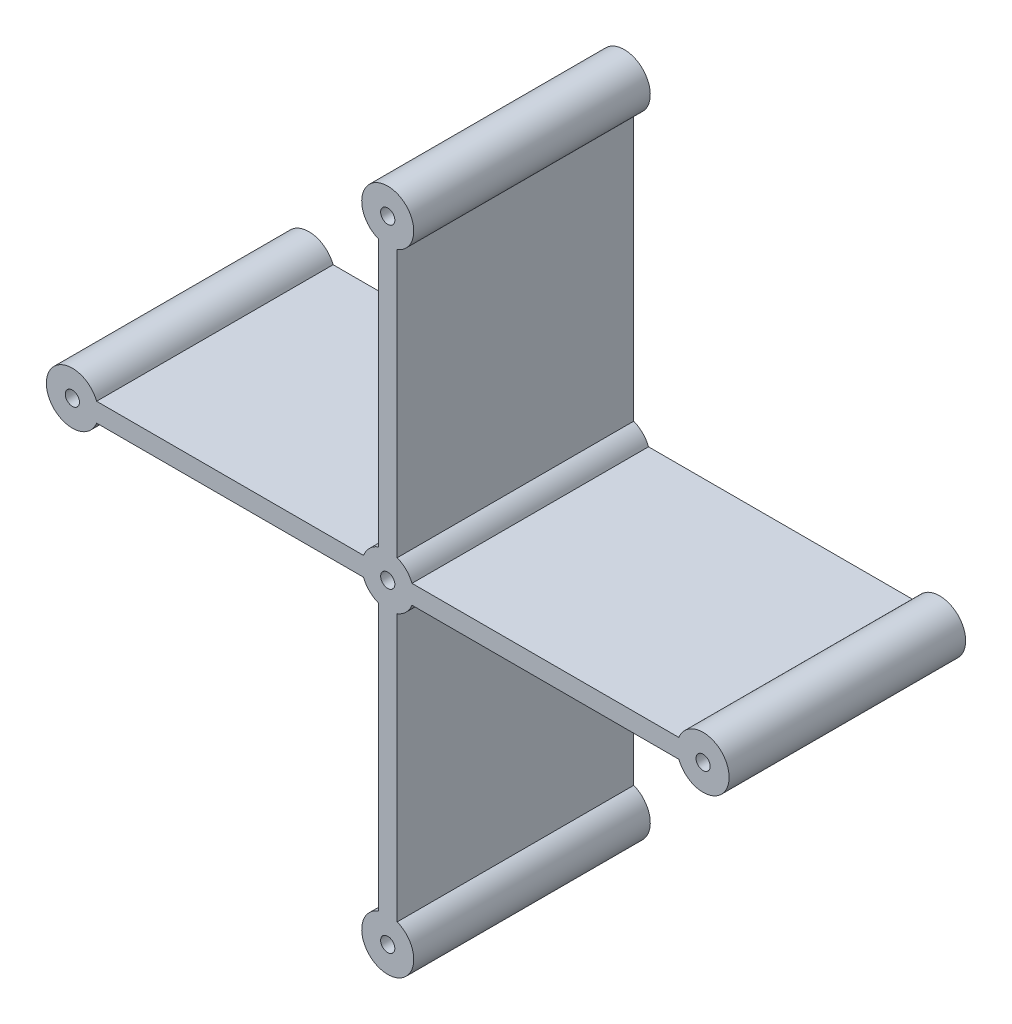
from build123d import *

# Parameters (mm, degrees)
BOSS_EXTRUDE1_DEPTH = 30
SKETCH1_3_R         = 0.9
CUT_EXTRUDE1_DEPTH  = 30


with BuildPart() as part:
    # Sketch1 → Boss-Extrude1 (new body)
    with BuildSketch(Plane.XY):
        with BuildLine():
            Line((-1.2, -1.2), (-1.2, 0))
            Line((-1.2, 0), (-1.2, 1.2))
            Line((-1.2, 1.2), (-3.07408523, 1.2))
            ThreePointArc((-3.07408523, 1.2), (-3.3, 0), (-3.07408523, -1.2))
            Line((-3.07408523, -1.2), (-1.2, -1.2))
        make_face()
        with BuildLine():
            ThreePointArc((0, -1.2), (-0.848528137, -0.848528137), (-1.2, 0))
            Line((-1.2, 0), (-1.2, -1.2))
            Line((-1.2, -1.2), (0, -1.2))
        make_face()
        with BuildLine():
            ThreePointArc((0, 1.2), (-0.848528137, 0.848528137), (-1.2, 0))
            ThreePointArc((-1.2, 0), (-0.848528137, -0.848528137), (0, -1.2))
            ThreePointArc((0, -1.2), (0.848528137, -0.848528137), (1.2, 0))
            ThreePointArc((1.2, 0), (0.848528137, 0.848528137), (0, 1.2))
        make_face()
        with BuildLine():
            Line((-1.2, 1.2), (-1.2, 0))
            ThreePointArc((-1.2, 0), (-0.848528137, 0.848528137), (0, 1.2))
            Line((0, 1.2), (-1.2, 1.2))
        make_face()
        with BuildLine():
            Line((-3.07408523, 1.2), (-1.2, 1.2))
            Line((-1.2, 1.2), (-1.2, 3.07408523))
            ThreePointArc((-1.2, 3.07408523), (-2.333452378, 2.333452378), (-3.07408523, 1.2))
        make_face()
        with BuildLine():
            Line((-1.2, 3.07408523), (-1.2, 1.2))
            Line((-1.2, 1.2), (0, 1.2))
            Line((0, 1.2), (1.2, 1.2))
            Line((1.2, 1.2), (1.2, 3.07408523))
            ThreePointArc((1.2, 3.07408523), (0, 3.3), (-1.2, 3.07408523))
        make_face()
        with BuildLine():
            Line((0, -1.2), (-1.2, -1.2))
            Line((-1.2, -1.2), (-1.2, -3.07408523))
            ThreePointArc((-1.2, -3.07408523), (0, -3.3), (1.2, -3.07408523))
            Line((1.2, -3.07408523), (1.2, -1.2))
            Line((1.2, -1.2), (0, -1.2))
        make_face()
        with BuildLine():
            Line((-1.2, -3.07408523), (-1.2, -1.2))
            Line((-1.2, -1.2), (-3.07408523, -1.2))
            ThreePointArc((-3.07408523, -1.2), (-2.333452378, -2.333452378), (-1.2, -3.07408523))
        make_face()
        with BuildLine():
            ThreePointArc((1.2, 0), (0.848528137, -0.848528137), (0, -1.2))
            Line((0, -1.2), (1.2, -1.2))
            Line((1.2, -1.2), (1.2, 0))
        make_face()
        with BuildLine():
            Line((1.2, 1.2), (0, 1.2))
            ThreePointArc((0, 1.2), (0.848528137, 0.848528137), (1.2, 0))
            Line((1.2, 0), (1.2, 1.2))
        make_face()
        with BuildLine():
            Line((-1.2, 36.92591477), (-1.2, 3.07408523))
            ThreePointArc((-1.2, 3.07408523), (0, 3.3), (1.2, 3.07408523))
            Line((1.2, 3.07408523), (1.2, 36.92591477))
            ThreePointArc((1.2, 36.92591477), (0, 36.7), (-1.2, 36.92591477))
        make_face()
        with BuildLine():
            ThreePointArc((-3.07408523, -1.2), (-3.3, 0), (-3.07408523, 1.2))
            Line((-3.07408523, 1.2), (-36.92591477, 1.2))
            ThreePointArc((-36.92591477, 1.2), (-36.756970455, 0.610540229), (-36.7, 0))
            ThreePointArc((-36.7, 0), (-36.756970455, -0.610540229), (-36.92591477, -1.2))
            Line((-36.92591477, -1.2), (-3.07408523, -1.2))
        make_face()
        with BuildLine():
            ThreePointArc((1.2, -3.07408523), (0, -3.3), (-1.2, -3.07408523))
            Line((-1.2, -3.07408523), (-1.2, -36.92591477))
            ThreePointArc((-1.2, -36.92591477), (0, -36.7), (1.2, -36.92591477))
            Line((1.2, -36.92591477), (1.2, -3.07408523))
        make_face()
        with BuildLine():
            Line((1.2, 0), (1.2, -1.2))
            Line((1.2, -1.2), (3.07408523, -1.2))
            ThreePointArc((3.07408523, -1.2), (3.243029545, -0.610540229), (3.3, 0))
            ThreePointArc((3.3, 0), (3.243029545, 0.610540229), (3.07408523, 1.2))
            Line((3.07408523, 1.2), (1.2, 1.2))
            Line((1.2, 1.2), (1.2, 0))
        make_face()
        with BuildLine():
            Line((3.07408523, -1.2), (1.2, -1.2))
            Line((1.2, -1.2), (1.2, -3.07408523))
            ThreePointArc((1.2, -3.07408523), (2.333452378, -2.333452378), (3.07408523, -1.2))
        make_face()
        with BuildLine():
            Line((1.2, 3.07408523), (1.2, 1.2))
            Line((1.2, 1.2), (3.07408523, 1.2))
            ThreePointArc((3.07408523, 1.2), (2.333452378, 2.333452378), (1.2, 3.07408523))
        make_face()
        with BuildLine():
            ThreePointArc((3.3, 40), (-1.861451047, 42.724885319), (-1.2, 36.92591477))
            Line((-1.2, 36.92591477), (-1.2, 40))
            ThreePointArc((-1.2, 40), (0, 41.2), (1.2, 40))
            Line((1.2, 40), (1.2, 36.92591477))
            ThreePointArc((1.2, 36.92591477), (2.724885319, 38.138548953), (3.3, 40))
        make_face()
        with BuildLine():
            Line((-1.2, 40), (-1.2, 36.92591477))
            ThreePointArc((-1.2, 36.92591477), (0, 36.7), (1.2, 36.92591477))
            Line((1.2, 36.92591477), (1.2, 40))
            ThreePointArc((1.2, 40), (0, 41.2), (-1.2, 40))
        make_face()
        with BuildLine():
            ThreePointArc((-36.7, 0), (-36.756970455, 0.610540229), (-36.92591477, 1.2))
            Line((-36.92591477, 1.2), (-40, 1.2))
            ThreePointArc((-40, 1.2), (-41.2, 0), (-40, -1.2))
            Line((-40, -1.2), (-36.92591477, -1.2))
            ThreePointArc((-36.92591477, -1.2), (-36.756970455, -0.610540229), (-36.7, 0))
        make_face()
        with BuildLine():
            Line((-40, 1.2), (-36.92591477, 1.2))
            ThreePointArc((-36.92591477, 1.2), (-43.3, 0), (-36.92591477, -1.2))
            Line((-36.92591477, -1.2), (-40, -1.2))
            ThreePointArc((-40, -1.2), (-41.2, 0), (-40, 1.2))
        make_face()
        with BuildLine():
            ThreePointArc((1.2, -36.92591477), (0, -36.7), (-1.2, -36.92591477))
            Line((-1.2, -36.92591477), (-1.2, -40))
            ThreePointArc((-1.2, -40), (0, -41.2), (1.2, -40))
            Line((1.2, -40), (1.2, -36.92591477))
        make_face()
        with BuildLine():
            Line((-1.2, -40), (-1.2, -36.92591477))
            ThreePointArc((-1.2, -36.92591477), (-1.861451047, -42.724885319), (3.3, -40))
            ThreePointArc((3.3, -40), (2.724885319, -38.138548953), (1.2, -36.92591477))
            Line((1.2, -36.92591477), (1.2, -40))
            ThreePointArc((1.2, -40), (0, -41.2), (-1.2, -40))
        make_face()
        with BuildLine():
            ThreePointArc((3.3, 0), (3.243029545, -0.610540229), (3.07408523, -1.2))
            Line((3.07408523, -1.2), (36.92591477, -1.2))
            ThreePointArc((36.92591477, -1.2), (36.7, 0), (36.92591477, 1.2))
            Line((36.92591477, 1.2), (3.07408523, 1.2))
            ThreePointArc((3.07408523, 1.2), (3.243029545, 0.610540229), (3.3, 0))
        make_face()
        with BuildLine():
            ThreePointArc((36.92591477, 1.2), (36.7, 0), (36.92591477, -1.2))
            Line((36.92591477, -1.2), (40, -1.2))
            ThreePointArc((40, -1.2), (41.2, 0), (40, 1.2))
            Line((40, 1.2), (36.92591477, 1.2))
        make_face()
        with BuildLine():
            Line((40, -1.2), (36.92591477, -1.2))
            ThreePointArc((36.92591477, -1.2), (40.610540229, -3.243029545), (43.3, 0))
            ThreePointArc((43.3, 0), (40.610540229, 3.243029545), (36.92591477, 1.2))
            Line((36.92591477, 1.2), (40, 1.2))
            ThreePointArc((40, 1.2), (41.2, 0), (40, -1.2))
        make_face()
    extrude(amount=BOSS_EXTRUDE1_DEPTH)

    # Sketch1<3> → Cut-Extrude1 (cut)
    with BuildSketch(Plane.XY):
        Circle(SKETCH1_3_R)
        with Locations((0, 40)):
            Circle(SKETCH1_3_R)
        with Locations((40, 0)):
            Circle(SKETCH1_3_R)
        with Locations((0, -40)):
            Circle(SKETCH1_3_R)
        with Locations((-40, 0)):
            Circle(SKETCH1_3_R)
    extrude(amount=CUT_EXTRUDE1_DEPTH, mode=Mode.SUBTRACT)


solid = part.part
